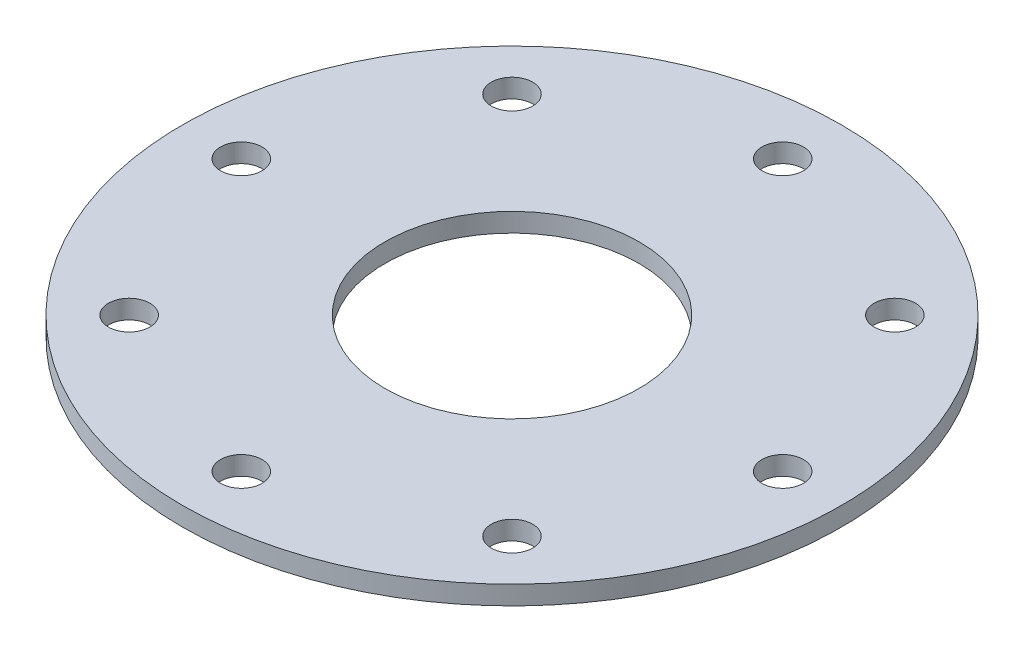
from build123d import *

# Parameters (mm, degrees)
SKETCH_1_R      = 70
SKETCH_1_R_2    = 27
SKETCH_1_R_3    = 4.4
EXTRUDE_1_DEPTH = 4


with BuildPart() as part:
    # Эскиз1 → Бобышка-Вытянуть1 (new body)
    with BuildSketch(Plane(origin=(0, 0, 0), x_dir=(1, 0, 0), z_dir=(0, 1, 0))):
        with Locations(Location((0, 0, 0), (0, 0, 270))):
            Circle(SKETCH_1_R)
        with Locations(Location((0, 0, 0), (0, 0, 270))):
            Circle(SKETCH_1_R_2, mode=Mode.SUBTRACT)
        with Locations(Location((57.5, 0, 0), (0, 0, 270))):
            Circle(SKETCH_1_R_3, mode=Mode.SUBTRACT)
        with Locations(Location((40.658639918, -40.658639918, 0), (0, 0, 270))):
            Circle(SKETCH_1_R_3, mode=Mode.SUBTRACT)
        with Locations(Location((0, -57.5, 0), (0, 0, 270))):
            Circle(SKETCH_1_R_3, mode=Mode.SUBTRACT)
        with Locations(Location((-40.658639918, -40.658639918, 0), (0, 0, 270))):
            Circle(SKETCH_1_R_3, mode=Mode.SUBTRACT)
        with Locations(Location((-57.5, 0, 0), (0, 0, 270))):
            Circle(SKETCH_1_R_3, mode=Mode.SUBTRACT)
        with Locations(Location((-40.658639918, 40.658639918, 0), (0, 0, 270))):
            Circle(SKETCH_1_R_3, mode=Mode.SUBTRACT)
        with Locations(Location((0, 57.5, 0), (0, 0, 270))):
            Circle(SKETCH_1_R_3, mode=Mode.SUBTRACT)
        with Locations(Location((40.658639918, 40.658639918, 0), (0, 0, 270))):
            Circle(SKETCH_1_R_3, mode=Mode.SUBTRACT)
    extrude(amount=EXTRUDE_1_DEPTH)


solid = part.part
